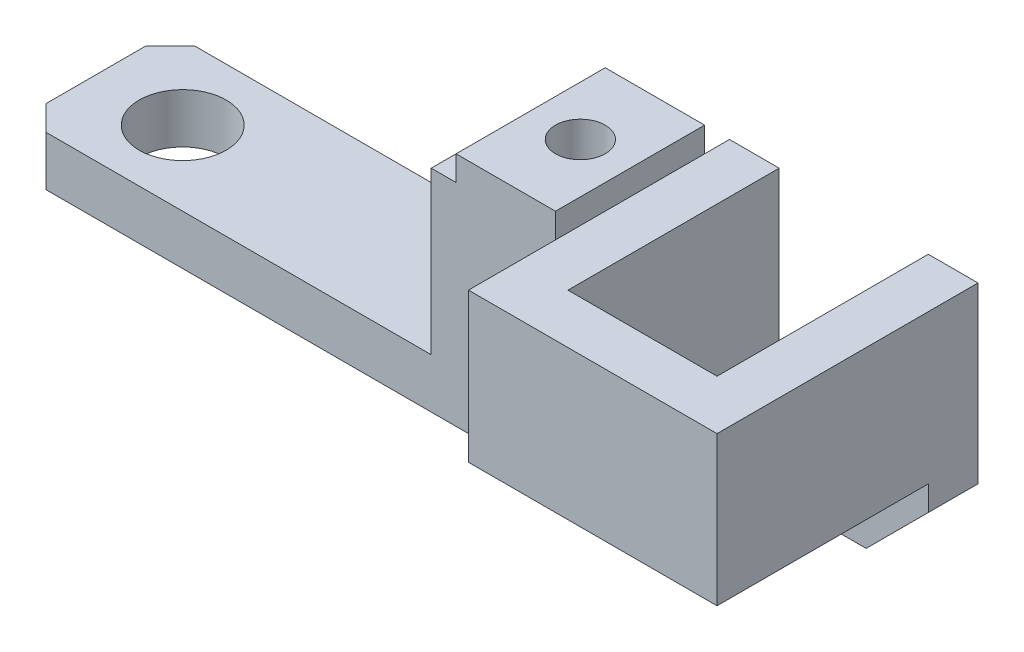
from build123d import *

# Parameters (mm, degrees)
SKETCH1_W           = 33
SKETCH1_H           = 12
SKETCH1_R           = 3.5
BOSS_EXTRUDE1_DEPTH = 4
SKETCH1_4_W         = 2
SKETCH1_4_H         = 12
BOSS_EXTRUDE2_DEPTH = 17
SKETCH1_5_W         = 8
SKETCH1_5_H         = 12
SKETCH1_5_R         = 2
BOSS_EXTRUDE3_DEPTH = 19
SKETCH1_6_W         = 20
SKETCH1_6_H         = 4
BOSS_EXTRUDE4_DEPTH = 7
BOSS_EXTRUDE5_DEPTH = 12
CHAMFER1_SIZE       = 2
SKETCH3_R           = 1.5
CUT_EXTRUDE1_DEPTH  = 50.560569004


with BuildPart() as part:
    # Sketch1 → Boss-Extrude1 (new body)
    with BuildSketch(Plane(origin=(0, 0, 0), x_dir=(1, 0, 0), z_dir=(0, 1, 0))):
        with Locations((-6, 0)):
            Rectangle(SKETCH1_W, SKETCH1_H)
        with Locations(Location((-15.5, 0, 0), (0, 0, 270))):
            Circle(SKETCH1_R, mode=Mode.SUBTRACT)
    extrude(amount=BOSS_EXTRUDE1_DEPTH)

    # Sketch1<4> → Boss-Extrude2 (add)
    with BuildSketch(Plane(origin=(0, 0, 0), x_dir=(1, 0, 0), z_dir=(0, 1, 0))):
        with Locations((11.5, 0)):
            Rectangle(SKETCH1_4_W, SKETCH1_4_H)
        Polygon((22.5, 6), (20.5, 6), (20.5, -6), (22.5, -6), (22.5, 2), align=None)
    extrude(amount=BOSS_EXTRUDE2_DEPTH)


with BuildPart() as boss_extrude2_piece_1:
    # of the separate pieces the step leaves, piece 1, a body of its own (boss_extrude2_pieces)
    add(part.part.solids().sort_by_distance((-22.5, 0, -6))[0])



with BuildPart() as boss_extrude2_piece_2:
    # of the separate pieces the step leaves, piece 2, a body of its own (boss_extrude2_pieces)
    add(part.part.solids().sort_by_distance((20.5, 0, 6))[0])


with BuildPart() as boss_extrude2_piece_1_1:
    add(boss_extrude2_piece_1.part)

    add(boss_extrude2_piece_2.part)  # Boss-Extrude3 merges Boss-Extrude2 piece 2
    # Sketch1<5> → Boss-Extrude3 (add)
    with BuildSketch(Plane(origin=(0, 0, 0), x_dir=(1, 0, 0), z_dir=(0, 1, 0))):
        with Locations((16.5, 0)):
            Rectangle(SKETCH1_5_W, SKETCH1_5_H)
        with Locations(Location((16.5, 0, 0), (0, 0, 270))):
            Circle(SKETCH1_5_R, mode=Mode.SUBTRACT)
    extrude(amount=BOSS_EXTRUDE3_DEPTH)

    # Sketch1<6> → Boss-Extrude4 (add)
    with BuildSketch(Plane(origin=(0, 0, 0), x_dir=(1, 0, 0), z_dir=(0, 1, 0))):
        with Locations((32.5, 4)):
            Rectangle(SKETCH1_6_W, SKETCH1_6_H)
    extrude(amount=BOSS_EXTRUDE4_DEPTH)

    # Sketch2 → Boss-Extrude5 (add)
    with BuildSketch(Plane(origin=(0, 7, 0), x_dir=(1, 0, 0), z_dir=(0, 1, 0))):
        Polygon((22.5, 6), (26.5, 6), (26.5, 2), (26.5, -11), (38.5, -11), (38.5, 2), (38.5, 6), (42.5, 6), (42.5, -15), (22.5, -15), align=None)
    extrude(amount=BOSS_EXTRUDE5_DEPTH)

    # Chamfer1
    chamfer1_edges = [boss_extrude2_piece_1_1.edges().sort_by_distance(p)[0] for p in [
        (-22.5, 2, 6),
        (-22.5, 2, -6),
    ]]
    chamfer(chamfer1_edges, length=CHAMFER1_SIZE)

    # Sketch3 → Cut-Extrude1 (cut, through all)
    with BuildSketch(Plane.XY.offset(-2)):
        with Locations((32.5, 4)):
            Circle(SKETCH3_R)
        Polygon((42.5, 0), (42.5, 5), (37.5, 0), align=None)
    extrude(amount=-CUT_EXTRUDE1_DEPTH, mode=Mode.SUBTRACT)


solid = boss_extrude2_piece_1_1.part
